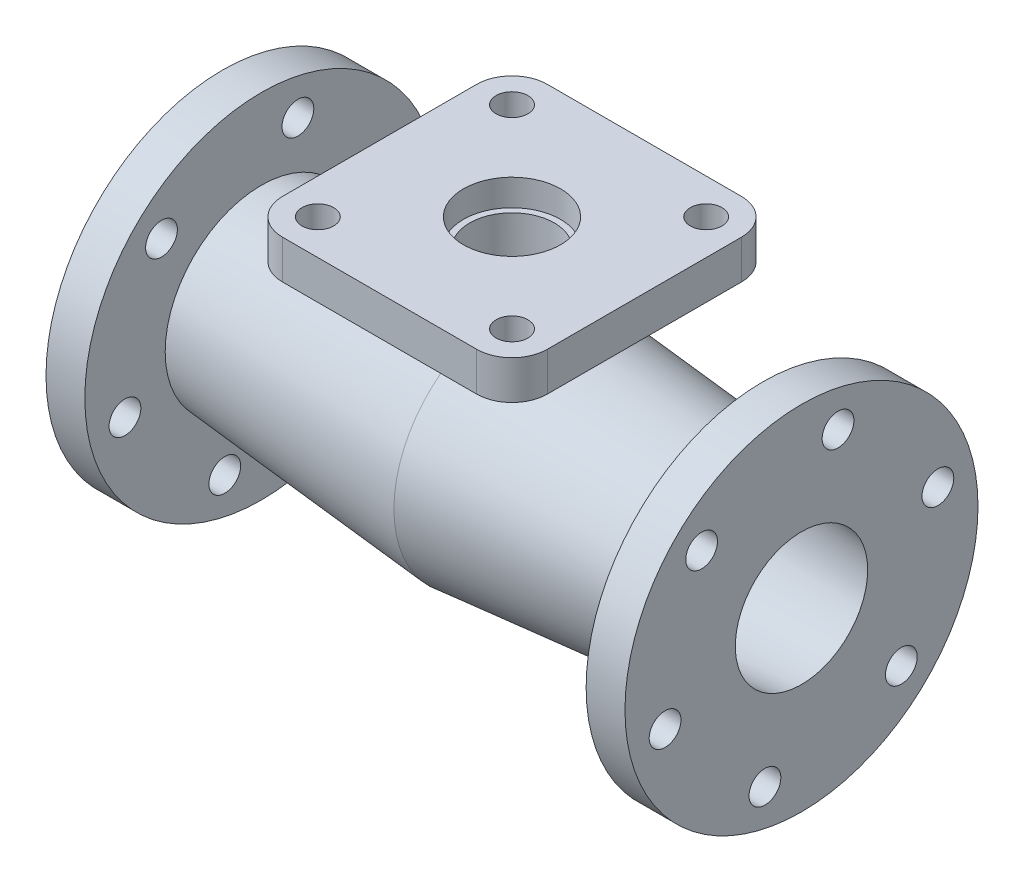
from build123d import *

# Parameters (mm, degrees)
SKETCH2_R           = 9
SKETCH2_R_2         = 40
BOSS_EXTRUDE1_DEPTH = 22
BOSS_EXTRUDE6_REACH = 286.598
SKETCH2_8_R         = 40
CUT_EXTRUDE5_REACH  = 362.117
SKETCH8_R           = 9


with BuildPart() as part:
    # Sketch1 → Revolve1 (revolve)
    with BuildSketch(Plane.XY):
        Polygon((-164, -37.5), (-164, -100), (-142, -100), (-142, -54.482048161), (0, -66.905438381), (142, -54.482048161), (142, -100), (164, -100), (164, -37.5), (0, -51.848140818), align=None)
    revolve(axis=Axis((0, 0, 0), (-1, 0, 0)))

    # Sketch2<8> → Boss-Extrude6 (add, up to next)
    with BuildSketch(Plane(origin=(0, 110, 0), x_dir=(1, 0, 0), z_dir=(0, 1, 0)), mode=Mode.PRIVATE) as boss_extrude6_sk1:
        Circle(SKETCH2_8_R)
    boss_extrude6_tool1 = extrude(boss_extrude6_sk1.sketch, amount=-BOSS_EXTRUDE6_REACH, mode=Mode.PRIVATE) - part.part


with BuildPart() as body_2:
    # Sketch2 → Boss-Extrude1 (new body)
    with BuildSketch(Plane(origin=(0, 110, 0), x_dir=(1, 0, 0), z_dir=(0, 1, 0))):
        with BuildLine():
            Line((55, 75), (-55, 75))
            ThreePointArc((-55, 75), (-69.142135624, 69.142135624), (-75, 55))
            Line((-75, 55), (-75, -55))
            ThreePointArc((-75, -55), (-69.142135624, -69.142135624), (-55, -75))
            Line((-55, -75), (55, -75))
            ThreePointArc((55, -75), (69.142135624, -69.142135624), (75, -55))
            Line((75, -55), (75, 55))
            ThreePointArc((75, 55), (69.142135624, 69.142135624), (55, 75))
        make_face()
        with Locations((-55, -55)):
            Circle(SKETCH2_R, mode=Mode.SUBTRACT)
        with Locations((55, -55)):
            Circle(SKETCH2_R, mode=Mode.SUBTRACT)
        with Locations((-55, 55)):
            Circle(SKETCH2_R, mode=Mode.SUBTRACT)
        Circle(SKETCH2_R_2, mode=Mode.SUBTRACT)
        with Locations((55, 55)):
            Circle(SKETCH2_R, mode=Mode.SUBTRACT)
    extrude(amount=-BOSS_EXTRUDE1_DEPTH)


with BuildPart() as part_1:
    add(part.part)

    add(body_2.part)  # Boss-Extrude6 merges body 2
    add(boss_extrude6_tool1.solids().sort_by_distance((0, 110, 0))[0])

    # Sketch7 → Cut-Revolve1 (revolve, cut)
    with BuildSketch(Plane.XY):
        Polygon((0, 19.40041476), (0, 110), (27.5, 110), (27.5, 95), (24, 95), (22.680404331, 19.40041476), align=None)
    revolve(axis=Axis((0, 0, 0), (0, -1, 0)), mode=Mode.SUBTRACT)

    # Sketch8 → Cut-Extrude5 (cut, up to next)
    with BuildSketch(Plane(origin=(164, 0, 0), x_dir=(0, 0, -1), z_dir=(1, 0, 0)), mode=Mode.PRIVATE) as cut_extrude5_sk1:
        with Locations((-77.274066103, -20.705523608)):
            Circle(SKETCH8_R)
    cut_extrude5_tool1 = extrude(cut_extrude5_sk1.sketch, amount=-CUT_EXTRUDE5_REACH, mode=Mode.PRIVATE) & part_1.part
    # Sketch8 → Cut-Extrude5 (cut, up to next)
    with BuildSketch(Plane(origin=(164, 0, 0), x_dir=(0, 0, -1), z_dir=(1, 0, 0)), mode=Mode.PRIVATE) as cut_extrude5_sk2:
        with Locations((-56.568542495, 56.568542495)):
            Circle(SKETCH8_R)
    cut_extrude5_tool2 = extrude(cut_extrude5_sk2.sketch, amount=-CUT_EXTRUDE5_REACH, mode=Mode.PRIVATE) & part_1.part
    # Sketch8 → Cut-Extrude5 (cut, up to next)
    with BuildSketch(Plane(origin=(164, 0, 0), x_dir=(0, 0, -1), z_dir=(1, 0, 0)), mode=Mode.PRIVATE) as cut_extrude5_sk3:
        with Locations((20.705523608, 77.274066103)):
            Circle(SKETCH8_R)
    cut_extrude5_tool3 = extrude(cut_extrude5_sk3.sketch, amount=-CUT_EXTRUDE5_REACH, mode=Mode.PRIVATE) & part_1.part
    # Sketch8 → Cut-Extrude5 (cut, up to next)
    with BuildSketch(Plane(origin=(164, 0, 0), x_dir=(0, 0, -1), z_dir=(1, 0, 0)), mode=Mode.PRIVATE) as cut_extrude5_sk4:
        with Locations((77.274066103, 20.705523608)):
            Circle(SKETCH8_R)
    cut_extrude5_tool4 = extrude(cut_extrude5_sk4.sketch, amount=-CUT_EXTRUDE5_REACH, mode=Mode.PRIVATE) & part_1.part
    # Sketch8 → Cut-Extrude5 (cut, up to next)
    with BuildSketch(Plane(origin=(164, 0, 0), x_dir=(0, 0, -1), z_dir=(1, 0, 0)), mode=Mode.PRIVATE) as cut_extrude5_sk5:
        with Locations((56.568542495, -56.568542495)):
            Circle(SKETCH8_R)
    cut_extrude5_tool5 = extrude(cut_extrude5_sk5.sketch, amount=-CUT_EXTRUDE5_REACH, mode=Mode.PRIVATE) & part_1.part
    # Sketch8 → Cut-Extrude5 (cut, up to next)
    with BuildSketch(Plane(origin=(164, 0, 0), x_dir=(0, 0, -1), z_dir=(1, 0, 0)), mode=Mode.PRIVATE) as cut_extrude5_sk6:
        with Locations((-20.705523608, -77.274066103)):
            Circle(SKETCH8_R)
    cut_extrude5_tool6 = extrude(cut_extrude5_sk6.sketch, amount=-CUT_EXTRUDE5_REACH, mode=Mode.PRIVATE) & part_1.part
    cut_extrude5_1 = cut_extrude5_tool1.solids().sort_by_distance((164, -20.705524, 77.274066))[0]
    add(cut_extrude5_1, mode=Mode.SUBTRACT)
    cut_extrude5_2 = cut_extrude5_tool2.solids().sort_by_distance((164, 56.568542, 56.568542))[0]
    add(cut_extrude5_2, mode=Mode.SUBTRACT)
    cut_extrude5_3 = cut_extrude5_tool3.solids().sort_by_distance((164, 77.274066, -20.705524))[0]
    add(cut_extrude5_3, mode=Mode.SUBTRACT)
    cut_extrude5_4 = cut_extrude5_tool4.solids().sort_by_distance((164, 20.705524, -77.274066))[0]
    add(cut_extrude5_4, mode=Mode.SUBTRACT)
    cut_extrude5_5 = cut_extrude5_tool5.solids().sort_by_distance((164, -56.568542, -56.568542))[0]
    add(cut_extrude5_5, mode=Mode.SUBTRACT)
    cut_extrude5_6 = cut_extrude5_tool6.solids().sort_by_distance((164, -77.274066, 20.705524))[0]
    add(cut_extrude5_6, mode=Mode.SUBTRACT)
    cut_extrude5 = cut_extrude5_1 + cut_extrude5_2 + cut_extrude5_3 + cut_extrude5_4 + cut_extrude5_5 + cut_extrude5_6  # Cut-Extrude5 as one shape, for the pattern or mirror that repeats it

    # Mirror1: Cut-Extrude5 across plane
    add(cut_extrude5.mirror(Plane(origin=(0, 0, 0), x_dir=(0, 0, 1), z_dir=(1, 0, 0))), mode=Mode.SUBTRACT)


solid = part_1.part
